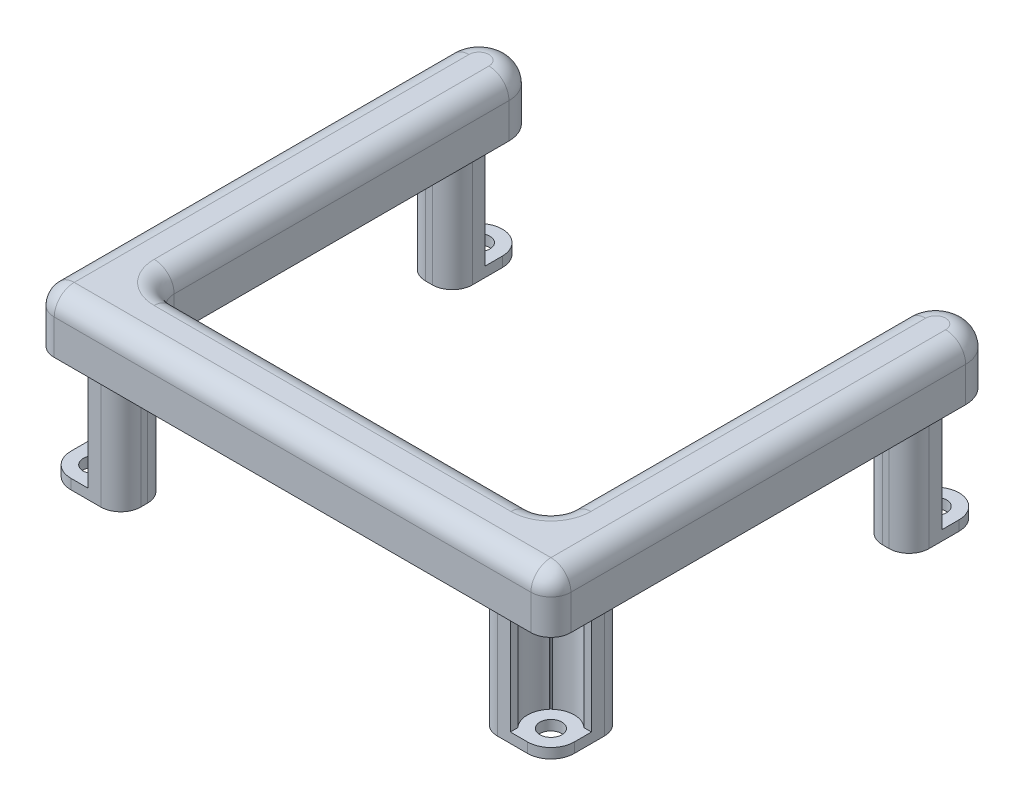
from build123d import *

# Parameters (mm, degrees)
SKETCH1_R             = 2.9718
SKETCH1_R_2           = 1.397
BOSS_EXTRUDE1_DEPTH   = 1.27
BOSS_EXTRUDE1_2_DEPTH = 1.27
BOSS_EXTRUDE1_3_DEPTH = 1.27
BOSS_EXTRUDE1_4_DEPTH = 1.27
BOSS_EXTRUDE2_DEPTH   = 6.985
FILLET1_R             = 2.54
BOSS_EXTRUDE3_DEPTH   = 1.27
BOSS_EXTRUDE4_DEPTH   = 13.081


with BuildPart() as part:
    # Sketch1 → Boss-Extrude1 (new body)
    with BuildSketch(Plane(origin=(0, 0, 0), x_dir=(1, 0, 0), z_dir=(0, 1, 0))):
        with Locations(Location((0, 0, 0), (0, 0, 270))):
            Circle(SKETCH1_R)
        with Locations(Location((0, 0, 0), (0, 0, 270))):
            Circle(SKETCH1_R_2, mode=Mode.SUBTRACT)
    extrude(amount=BOSS_EXTRUDE1_DEPTH)



with BuildPart() as body_2:
    # Sketch1 → Boss-Extrude1 2 (new body)
    with BuildSketch(Plane(origin=(0, 0, 0), x_dir=(1, 0, 0), z_dir=(0, 1, 0))):
        with Locations(Location((58.039, 0, 0), (0, 0, 90))):
            Circle(SKETCH1_R)
        with Locations(Location((58.039, 0, 0), (0, 0, 90))):
            Circle(SKETCH1_R_2, mode=Mode.SUBTRACT)
    extrude(amount=BOSS_EXTRUDE1_2_DEPTH)


with BuildPart() as body_3:
    # Sketch1 → Boss-Extrude1 3 (new body)
    with BuildSketch(Plane(origin=(0, 0, 0), x_dir=(1, 0, 0), z_dir=(0, 1, 0))):
        with Locations(Location((58.039, 48.895, 0), (0, 0, 270))):
            Circle(SKETCH1_R)
        with Locations(Location((58.039, 48.895, 0), (0, 0, 270))):
            Circle(SKETCH1_R_2, mode=Mode.SUBTRACT)
    extrude(amount=BOSS_EXTRUDE1_3_DEPTH)


with BuildPart() as body_4:
    # Sketch1 → Boss-Extrude1 4 (new body)
    with BuildSketch(Plane(origin=(0, 0, 0), x_dir=(1, 0, 0), z_dir=(0, 1, 0))):
        with Locations(Location((0, 48.895, 0), (0, 0, 90))):
            Circle(SKETCH1_R)
        with Locations(Location((0, 48.895, 0), (0, 0, 90))):
            Circle(SKETCH1_R_2, mode=Mode.SUBTRACT)
    extrude(amount=BOSS_EXTRUDE1_4_DEPTH)


with BuildPart() as body_5:
    # Sketch2 → Boss-Extrude2 (new body)
    with BuildSketch(Plane(origin=(0, 14.351, 0), x_dir=(1, 0, 0), z_dir=(0, 1, 0))):
        with BuildLine():
            Line((-3.81, 48.895), (-3.81, -1.27))
            ThreePointArc((-3.81, -1.27), (-3.066051224, -3.066051224), (-1.27, -3.81))
            Line((-1.27, -3.81), (59.309, -3.81))
            ThreePointArc((59.309, -3.81), (61.105051224, -3.066051224), (61.849, -1.27))
            Line((61.849, -1.27), (61.849, 48.895))
            ThreePointArc((61.849, 48.895), (58.039, 52.705), (54.229, 48.895))
            Line((54.229, 48.895), (54.229, 6.35))
            ThreePointArc((54.229, 6.35), (53.485051224, 4.553948776), (51.689, 3.81))
            Line((51.689, 3.81), (6.35, 3.81))
            ThreePointArc((6.35, 3.81), (4.553948776, 4.553948776), (3.81, 6.35))
            Line((3.81, 6.35), (3.81, 48.895))
            ThreePointArc((3.81, 48.895), (0, 52.705), (-3.81, 48.895))
        make_face()
    extrude(amount=BOSS_EXTRUDE2_DEPTH)

    # Fillet1
    fillet1_edges = [body_5.edges().sort_by_distance(p)[0] for p in [
        (-3.066051224, 21.336, 3.066051224),
        (29.0195, 21.336, 3.81),
        (61.105051224, 21.336, 3.066051224),
        (61.849, 21.336, -23.8125),
        (58.039, 21.336, -52.705),
        (54.229, 21.336, -27.6225),
        (53.485051224, 21.336, -4.553948776),
        (29.0195, 21.336, -3.81),
        (4.553948776, 21.336, -4.553948776),
        (3.81, 21.336, -27.6225),
        (0, 21.336, -52.705),
        (-3.81, 21.336, -23.8125),
    ]]
    fillet(fillet1_edges, radius=FILLET1_R)


with BuildPart() as part_1:
    add(part.part)

    add(body_2.part)  # Boss-Extrude3 merges body 2

    add(body_3.part)  # Boss-Extrude3 merges body 3

    add(body_4.part)  # Boss-Extrude3 merges body 4
    # Sketch3 → Boss-Extrude3 (add)
    with BuildSketch(Plane.XZ):
        with BuildLine():
            Line((-1.397, -48.895), (-2.9718, -48.895))
            Line((-2.9718, -48.895), (-2.9718, -45.085))
            ThreePointArc((-2.9718, -45.085), (-2.227851224, -43.288948776), (-0.4318, -42.545))
            Line((-0.4318, -42.545), (0.4318, -42.545))
            ThreePointArc((0.4318, -42.545), (2.227851224, -43.288948776), (2.9718, -45.085))
            Line((2.9718, -45.085), (2.9718, -48.895))
            Line((2.9718, -48.895), (1.397, -48.895))
            ThreePointArc((1.397, -48.895), (0, -47.498), (-1.397, -48.895))
        make_face()
        with BuildLine():
            Line((-2.9718, -3.81), (-2.9718, 0))
            Line((-2.9718, 0), (-1.397, 0))
            ThreePointArc((-1.397, 0), (0.987828173, -0.987828173), (0, 1.397))
            Line((0, 1.397), (0, 2.9718))
            Line((0, 2.9718), (3.81, 2.9718))
            ThreePointArc((3.81, 2.9718), (5.606051224, 2.227851224), (6.35, 0.4318))
            Line((6.35, 0.4318), (6.35, -0.4318))
            ThreePointArc((6.35, -0.4318), (5.606051224, -2.227851224), (3.81, -2.9718))
            Line((3.81, -2.9718), (2.9718, -2.9718))
            Line((2.9718, -2.9718), (2.9718, -3.81))
            ThreePointArc((2.9718, -3.81), (2.227851224, -5.606051224), (0.4318, -6.35))
            Line((0.4318, -6.35), (-0.4318, -6.35))
            ThreePointArc((-0.4318, -6.35), (-2.227851224, -5.606051224), (-2.9718, -3.81))
        make_face()
        with BuildLine():
            Line((59.436, 0), (61.0108, 0))
            Line((61.0108, 0), (61.0108, -3.81))
            ThreePointArc((61.0108, -3.81), (60.266851224, -5.606051224), (58.4708, -6.35))
            Line((58.4708, -6.35), (57.6072, -6.35))
            ThreePointArc((57.6072, -6.35), (55.811148776, -5.606051224), (55.0672, -3.81))
            Line((55.0672, -3.81), (55.0672, -2.9718))
            Line((55.0672, -2.9718), (54.229, -2.9718))
            ThreePointArc((54.229, -2.9718), (52.432948776, -2.227851224), (51.689, -0.4318))
            Line((51.689, -0.4318), (51.689, 0.4318))
            ThreePointArc((51.689, 0.4318), (52.432948776, 2.227851224), (54.229, 2.9718))
            Line((54.229, 2.9718), (58.039, 2.9718))
            Line((58.039, 2.9718), (58.039, 1.397))
            ThreePointArc((58.039, 1.397), (57.051171827, -0.987828173), (59.436, 0))
        make_face()
        with BuildLine():
            Line((61.0108, -45.085), (61.0108, -48.895))
            Line((61.0108, -48.895), (59.436, -48.895))
            ThreePointArc((59.436, -48.895), (58.039, -47.498), (56.642, -48.895))
            Line((56.642, -48.895), (55.0672, -48.895))
            Line((55.0672, -48.895), (55.0672, -45.085))
            ThreePointArc((55.0672, -45.085), (55.811148776, -43.288948776), (57.6072, -42.545))
            Line((57.6072, -42.545), (58.4708, -42.545))
            ThreePointArc((58.4708, -42.545), (60.266851224, -43.288948776), (61.0108, -45.085))
        make_face()
    extrude(amount=-BOSS_EXTRUDE3_DEPTH)


    add(body_5.part)  # Boss-Extrude4 merges body 5
    # Sketch4 → Boss-Extrude4 (add)
    with BuildSketch(Plane(origin=(0, 1.27, 0), x_dir=(1, 0, 0), z_dir=(0, 1, 0))):
        with BuildLine():
            Line((-2.9718, 46.7106), (-2.014942153, 46.7106))
            ThreePointArc((-2.014942153, 46.7106), (0, 45.9232), (2.014942153, 46.7106))
            Line((2.014942153, 46.7106), (2.9718, 46.7106))
            Line((2.9718, 46.7106), (2.9718, 45.085))
            ThreePointArc((2.9718, 45.085), (2.227851224, 43.288948776), (0.4318, 42.545))
            Line((0.4318, 42.545), (-0.4318, 42.545))
            ThreePointArc((-0.4318, 42.545), (-2.227851224, 43.288948776), (-2.9718, 45.085))
            Line((-2.9718, 45.085), (-2.9718, 46.7106))
        make_face()
        with BuildLine():
            Line((56.024057847, 46.7106), (55.0672, 46.7106))
            Line((55.0672, 46.7106), (55.0672, 45.085))
            ThreePointArc((55.0672, 45.085), (55.811148776, 43.288948776), (57.6072, 42.545))
            Line((57.6072, 42.545), (58.4708, 42.545))
            ThreePointArc((58.4708, 42.545), (60.266851224, 43.288948776), (61.0108, 45.085))
            Line((61.0108, 45.085), (61.0108, 46.7106))
            Line((61.0108, 46.7106), (60.053942153, 46.7106))
            ThreePointArc((60.053942153, 46.7106), (58.039, 45.9232), (56.024057847, 46.7106))
        make_face()
        with BuildLine():
            Line((2.014942153, 2.1844), (2.1844, 2.1844))
            Line((2.1844, 2.1844), (2.1844, 2.014942153))
            ThreePointArc((2.1844, 2.014942153), (2.9718, 0), (2.1844, -2.014942153))
            Line((2.1844, -2.014942153), (2.1844, -2.9718))
            Line((2.1844, -2.9718), (3.81, -2.9718))
            ThreePointArc((3.81, -2.9718), (5.606051224, -2.227851224), (6.35, -0.4318))
            Line((6.35, -0.4318), (6.35, 0.4318))
            ThreePointArc((6.35, 0.4318), (5.606051224, 2.227851224), (3.81, 2.9718))
            Line((3.81, 2.9718), (2.9718, 2.9718))
            Line((2.9718, 2.9718), (2.9718, 3.81))
            ThreePointArc((2.9718, 3.81), (2.227851224, 5.606051224), (0.4318, 6.35))
            Line((0.4318, 6.35), (-0.4318, 6.35))
            ThreePointArc((-0.4318, 6.35), (-2.227851224, 5.606051224), (-2.9718, 3.81))
            Line((-2.9718, 3.81), (-2.9718, 2.1844))
            Line((-2.9718, 2.1844), (-2.014942153, 2.1844))
            ThreePointArc((-2.014942153, 2.1844), (0, 2.9718), (2.014942153, 2.1844))
        make_face()
        with BuildLine():
            Line((55.8546, 2.014942153), (55.8546, 2.1844))
            Line((55.8546, 2.1844), (56.024057847, 2.1844))
            ThreePointArc((56.024057847, 2.1844), (58.039, 2.9718), (60.053942153, 2.1844))
            Line((60.053942153, 2.1844), (61.0108, 2.1844))
            Line((61.0108, 2.1844), (61.0108, 3.81))
            ThreePointArc((61.0108, 3.81), (60.266851224, 5.606051224), (58.4708, 6.35))
            Line((58.4708, 6.35), (57.6072, 6.35))
            ThreePointArc((57.6072, 6.35), (55.811148776, 5.606051224), (55.0672, 3.81))
            Line((55.0672, 3.81), (55.0672, 2.9718))
            Line((55.0672, 2.9718), (54.229, 2.9718))
            ThreePointArc((54.229, 2.9718), (52.432948776, 2.227851224), (51.689, 0.4318))
            Line((51.689, 0.4318), (51.689, -0.4318))
            ThreePointArc((51.689, -0.4318), (52.432948776, -2.227851224), (54.229, -2.9718))
            Line((54.229, -2.9718), (55.8546, -2.9718))
            Line((55.8546, -2.9718), (55.8546, -2.014942153))
            ThreePointArc((55.8546, -2.014942153), (55.0672, 0), (55.8546, 2.014942153))
        make_face()
    extrude(amount=BOSS_EXTRUDE4_DEPTH)


solid = part_1.part
